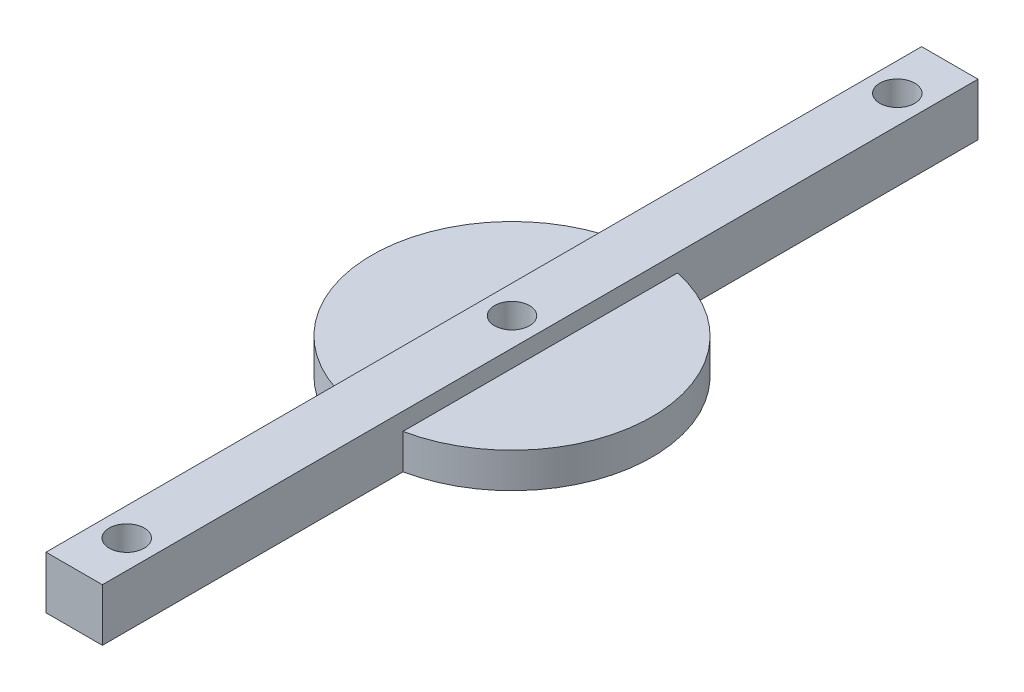
from build123d import *

# Parameters (mm, degrees)
CROQUIS1_W                 = 16.099128824
CROQUIS1_H                 = 250
SALIENTE_EXTRUIR1_DEPTH    = 15
CROQUIS2_R                 = 40
SALIENTE_EXTRUIR2_DEPTH    = 10
CORTAR_EXTRUIR1_DEPTH      = 133.098448136
CORTAR_EXTRUIR1_DEPTH_BACK = 133.098448136
CROQUIS3_R                 = 5


with BuildPart() as part:
    # Croquis1 → Saliente-Extruir1 (new body)
    with BuildSketch(Plane(origin=(0, 0, 0), x_dir=(1, 0, 0), z_dir=(0, 1, 0))):
        Rectangle(CROQUIS1_W, CROQUIS1_H)
    extrude(amount=SALIENTE_EXTRUIR1_DEPTH)

    # Croquis2 → Saliente-Extruir2 (add)
    with BuildSketch(Plane(origin=(0, 0, 0), x_dir=(1, 0, 0), z_dir=(0, 1, 0))):
        Circle(CROQUIS2_R)
    extrude(amount=SALIENTE_EXTRUIR2_DEPTH)

    # Croquis3 → Cortar-Extruir1 (cut, two sides: drawn at the far end of the back side and taken through both)
    with BuildSketch(Plane(origin=(0, 0, 0), x_dir=(1, 0, 0), z_dir=(0, 1, 0)).offset(-CORTAR_EXTRUIR1_DEPTH_BACK)):
        with Locations(Location((0, 0, 0), (0, 0, 270))):
            Circle(CROQUIS3_R)
        with Locations(Location((0, 110, 0), (0, 0, 270))):
            Circle(CROQUIS3_R)
        with Locations(Location((0, -110, 0), (0, 0, 90))):
            Circle(CROQUIS3_R)
    extrude(amount=CORTAR_EXTRUIR1_DEPTH + CORTAR_EXTRUIR1_DEPTH_BACK, mode=Mode.SUBTRACT)


solid = part.part
